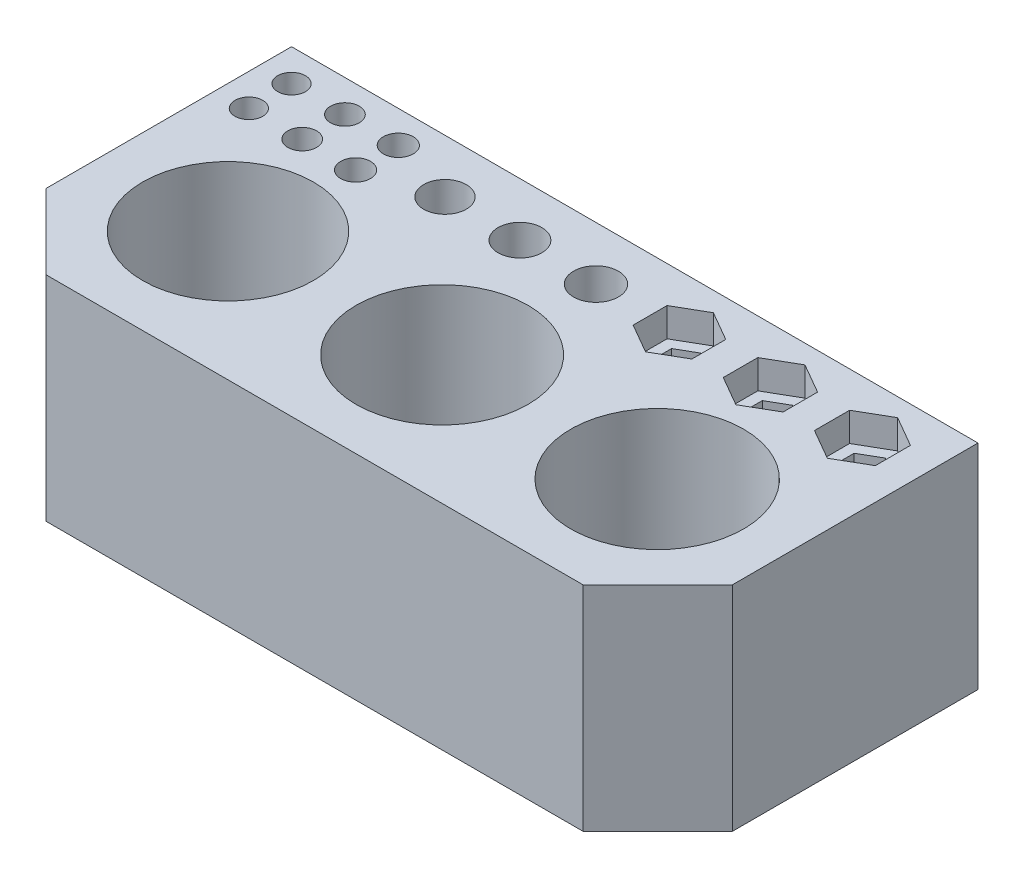
from build123d import *

# Parameters (mm, degrees)
SKETCH1_W             = 64.3
SKETCH1_H             = 30
BOSS_EXTRUDE1_DEPTH   = 20
VARILLAS_START        = 20
SKETCH1_3_R           = 8.05
SKETCH1_3_R_2         = 8.1
SKETCH1_3_R_3         = 8
VARILLAS_HUECAS_DEPTH = 15
TORNILLOS_START       = 20
SKETCH1_4_R           = 1.35
SKETCH1_4_R_2         = 1.4
SKETCH1_4_R_3         = 1.3
TORNILLOS_ALEM_DEPTH  = 12
TORNILLOS_PCB_DEPTH   = 2.7
SKETCH1_5_R           = 2
SKETCH1_5_R_2         = 2.05
SKETCH1_5_R_3         = 2.1
VARILLAS_SERVOS_DEPTH = 20
CHAMFER1_SIZE         = 7
CUT_EXTRUDE5_REACH    = 41.47
CUT_EXTRUDE6_START    = 20
SKETCH1_7_R           = 1.35
SKETCH1_7_R_2         = 1.3
SKETCH1_7_R_3         = 1.4
CUT_EXTRUDE6_DEPTH    = 3.5


with BuildPart() as part:
    # Sketch1 → Boss-Extrude1 (new body)
    with BuildSketch(Plane(origin=(0, 0, 0), x_dir=(1, 0, 0), z_dir=(0, 1, 0))):
        Rectangle(SKETCH1_W, SKETCH1_H)
    extrude(amount=BOSS_EXTRUDE1_DEPTH)

    # Sketch1<3> → Varillas huecas (cut)
    with BuildSketch(Plane(origin=(0, 0, 0), x_dir=(1, 0, 0), z_dir=(0, 1, 0)).offset(VARILLAS_START)):
        with Locations(Location((-0.1, -2.95, 0), (0, 0, 90))):
            Circle(SKETCH1_3_R)
        with Locations(Location((20.05, -2.95, 0), (0, 0, 90))):
            Circle(SKETCH1_3_R_2)
        with Locations(Location((-20.15, -2.95, 0), (0, 0, 90))):
            Circle(SKETCH1_3_R_3)
    extrude(amount=-VARILLAS_HUECAS_DEPTH, mode=Mode.SUBTRACT)

    # Sketch1<4> → Tornillos Alem (cut)
    with BuildSketch(Plane(origin=(0, 0, 0), x_dir=(1, 0, 0), z_dir=(0, 1, 0)).offset(TORNILLOS_START)):
        with Locations(Location((-24.15, 12, 0), (0, 0, 90))):
            Circle(SKETCH1_4_R)
        with Locations(Location((-19.15, 12, 0), (0, 0, 90))):
            Circle(SKETCH1_4_R_2)
        with Locations(Location((-29.15, 12, 0), (0, 0, 90))):
            Circle(SKETCH1_4_R_3)
    extrude(amount=-TORNILLOS_ALEM_DEPTH, mode=Mode.SUBTRACT)

    # Sketch1<6> → Tornillos PCB (cut)
    with BuildSketch(Plane(origin=(0, 0, 0), x_dir=(1, 0, 0), z_dir=(0, 1, 0)).offset(TORNILLOS_START)):
        Polygon((9.185714286, 6.824573519), (11.935714286, 8.41228676), (11.935714286, 11.58771324), (9.185714286, 13.175426481), (6.435714286, 11.58771324), (6.435714286, 8.41228676), align=None)
        Polygon((17.707142857, 6.766838493), (20.507142857, 8.383419246), (20.507142857, 11.616580754), (17.707142857, 13.233161507), (14.907142857, 11.616580754), (14.907142857, 8.383419246), align=None)
        Polygon((26.328571429, 6.709103466), (29.178571429, 8.354551733), (29.178571429, 11.645448267), (26.328571429, 13.290896534), (23.478571429, 11.645448267), (23.478571429, 8.354551733), align=None)
    extrude(amount=-TORNILLOS_PCB_DEPTH, mode=Mode.SUBTRACT)

    # Sketch1<5> → Varillas servos (cut)
    with BuildSketch(Plane(origin=(0, 0, 0), x_dir=(1, 0, 0), z_dir=(0, 1, 0)).offset(VARILLAS_START)):
        with Locations(Location((-12.778571429, 10, 0), (0, 0, 90))):
            Circle(SKETCH1_5_R)
        with Locations(Location((-5.757142857, 10, 0), (0, 0, 90))):
            Circle(SKETCH1_5_R_2)
        with Locations(Location((1.364285714, 10, 0), (0, 0, 90))):
            Circle(SKETCH1_5_R_3)
    extrude(amount=-VARILLAS_SERVOS_DEPTH, mode=Mode.SUBTRACT)

    # Chamfer1
    chamfer1_edges = [part.edges().sort_by_distance(p)[0] for p in [
        (-32.15, 10, 15),
        (32.15, 10, 15),
    ]]
    chamfer(chamfer1_edges, length=CHAMFER1_SIZE)

    # Sketch2 → Cut-Extrude5 (cut, up to next)
    with BuildSketch(Plane(origin=(0, 17.3, 0), x_dir=(1, 0, 0), z_dir=(0, 1, 0)), mode=Mode.PRIVATE) as cut_extrude5_sk1:
        Polygon((24.478571429, 11.068097998), (24.478571429, 8.931902002), (26.328571429, 7.863804004), (28.178571429, 8.931902002), (28.178571429, 11.068097998), (26.328571429, 12.136195996), align=None)
    cut_extrude5_tool1 = extrude(cut_extrude5_sk1.sketch, amount=-CUT_EXTRUDE5_REACH, mode=Mode.PRIVATE) & part.part
    # Sketch2 → Cut-Extrude5 (cut, up to next)
    with BuildSketch(Plane(origin=(0, 17.3, 0), x_dir=(1, 0, 0), z_dir=(0, 1, 0)), mode=Mode.PRIVATE) as cut_extrude5_sk2:
        Polygon((15.907142857, 11.039230485), (15.907142857, 8.960769515), (17.707142857, 7.921539031), (19.507142857, 8.960769515), (19.507142857, 11.039230485), (17.707142857, 12.078460969), align=None)
    cut_extrude5_tool2 = extrude(cut_extrude5_sk2.sketch, amount=-CUT_EXTRUDE5_REACH, mode=Mode.PRIVATE) & part.part
    # Sketch2 → Cut-Extrude5 (cut, up to next)
    with BuildSketch(Plane(origin=(0, 17.3, 0), x_dir=(1, 0, 0), z_dir=(0, 1, 0)), mode=Mode.PRIVATE) as cut_extrude5_sk3:
        Polygon((10.935714286, 11.010362971), (9.185714286, 12.020725942), (7.435714286, 11.010362971), (7.435714286, 8.989637029), (9.185714286, 7.979274058), (10.935714286, 8.989637029), align=None)
    cut_extrude5_tool3 = extrude(cut_extrude5_sk3.sketch, amount=-CUT_EXTRUDE5_REACH, mode=Mode.PRIVATE) & part.part
    add(cut_extrude5_tool1.solids().sort_by_distance((26.328571, 17.3, -10))[0], mode=Mode.SUBTRACT)
    add(cut_extrude5_tool2.solids().sort_by_distance((17.707143, 17.3, -10))[0], mode=Mode.SUBTRACT)
    add(cut_extrude5_tool3.solids().sort_by_distance((9.185714, 17.3, -10))[0], mode=Mode.SUBTRACT)

    # Sketch1<7> → Cut-Extrude6 (cut)
    with BuildSketch(Plane(origin=(0, 0, 0), x_dir=(1, 0, 0), z_dir=(0, 1, 0)).offset(CUT_EXTRUDE6_START)):
        with Locations(Location((-24.15, 8, 0), (0, 0, 90))):
            Circle(SKETCH1_7_R)
        with Locations(Location((-29.15, 8, 0), (0, 0, 90))):
            Circle(SKETCH1_7_R_2)
        with Locations(Location((-19.15, 8, 0), (0, 0, 90))):
            Circle(SKETCH1_7_R_3)
    extrude(amount=-CUT_EXTRUDE6_DEPTH, mode=Mode.SUBTRACT)


solid = part.part
